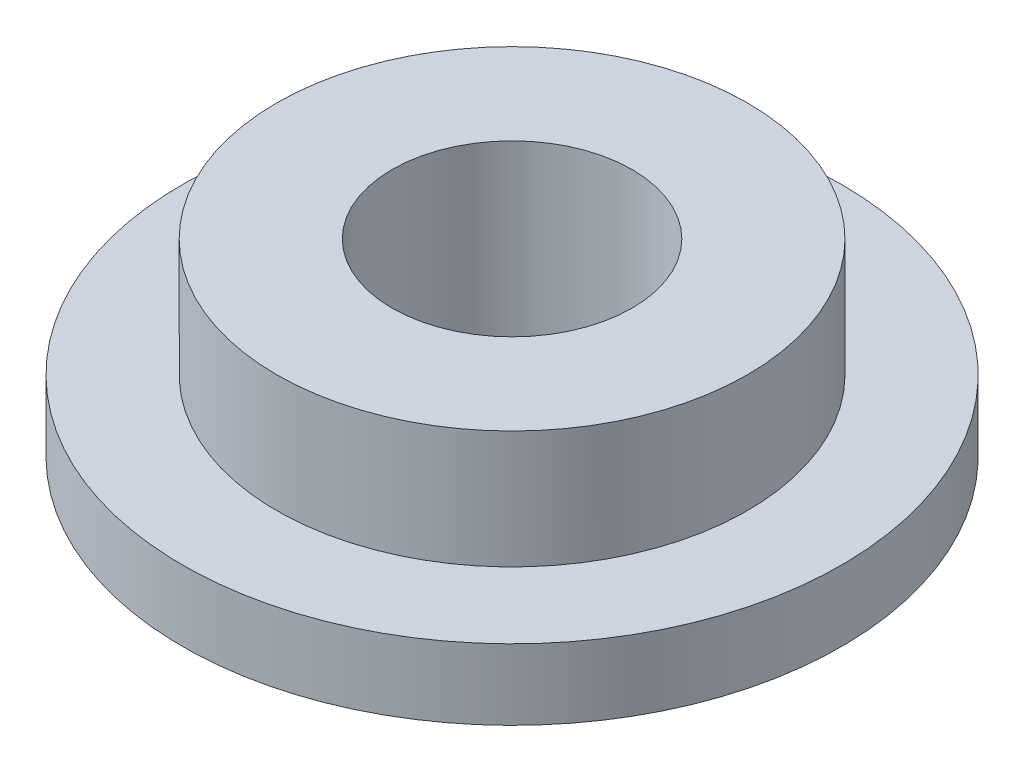
from build123d import *

# Parameters (mm, degrees)
SKETCH1_R           = 5
SKETCH1_R_2         = 2.55
BOSS_EXTRUDE1_DEPTH = 4
SKETCH2_R           = 7
SKETCH2_R_2         = 5
BOSS_EXTRUDE2_DEPTH = 1.5


with BuildPart() as part:
    # Sketch1 → Boss-Extrude1 (new body)
    with BuildSketch(Plane(origin=(0, 0, 0), x_dir=(1, 0, 0), z_dir=(0, 1, 0))):
        with Locations(Location((0, 0, 0), (0, 0, 270))):
            Circle(SKETCH1_R)
        with Locations(Location((0, 0, 0), (0, 0, 270))):
            Circle(SKETCH1_R_2, mode=Mode.SUBTRACT)
    extrude(amount=BOSS_EXTRUDE1_DEPTH)

    # Sketch2 → Boss-Extrude2 (add)
    with BuildSketch(Plane(origin=(0, 0, 0), x_dir=(-1, 0, 0), z_dir=(0, -1, 0))):
        with Locations(Location((0, 0, 0), (0, 0, 90))):
            Circle(SKETCH2_R)
        with Locations(Location((0, 0, 0), (0, 0, 90))):
            Circle(SKETCH2_R_2, mode=Mode.SUBTRACT)
    extrude(amount=-BOSS_EXTRUDE2_DEPTH)


solid = part.part
